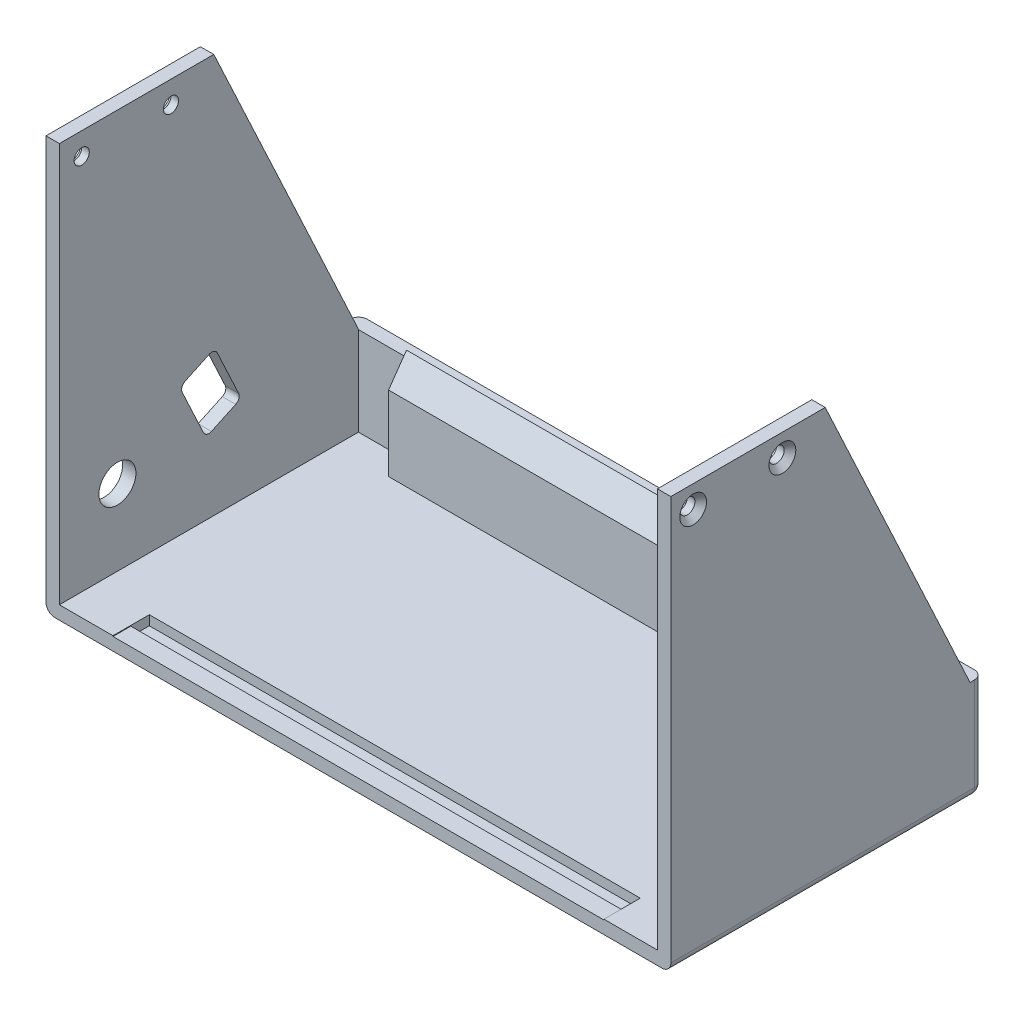
from build123d import *

# Parameters (mm, degrees)
SCHIZZO1_W                         = 140
SCHIZZO1_H                         = 70
ESTRUSIONE_ESTRUSIONE1_DEPTH       = 3
ESTRUSIONE_ESTRUSIONE2_DEPTH       = 110
SCHIZZO4_W                         = 3
SCHIZZO4_H                         = 19.9
ESTRUSIONE_ESTRUSIONE3_DEPTH       = 140
SCHIZZO5_W                         = 3
SCHIZZO5_H                         = 67
ESTRUSIONE_ESTRUSIONE4_DEPTH       = 89.5
TAGLIO_ESTRUSIONE1_REACH           = 183.814
TAGLIO_ESTRUSIONE3_DEPTH           = 110
RACCORDO1_R                        = 2
SCHIZZO8_R                         = 1.7
TAGLIO_ESTRUSIONE4_DEPTH           = 182.813778356
SCHIZZO10_R                        = 3
TAGLIO_ESTRUSIONE5_DEPTH           = 2
TAGLIO_ESTRUSIONE5_DRAFT           = -45
TAGLIO_ESTRUSIONE5_PROFILE_2_DEPTH = 2
TAGLIO_ESTRUSIONE5_PROFILE_2_DRAFT = -45
SCHIZZO11_R                        = 3
TAGLIO_ESTRUSIONE6_DEPTH           = 2
TAGLIO_ESTRUSIONE6_DRAFT           = -45
TAGLIO_ESTRUSIONE6_PROFILE_2_DEPTH = 2
TAGLIO_ESTRUSIONE6_PROFILE_2_DRAFT = -45
TAGLIO_ESTRUSIONE7_DEPTH           = 3
SCHIZZO13_R                        = 4.15
TAGLIO_ESTRUSIONE8_DEPTH           = 10


with BuildPart() as part:
    # Schizzo1 → Estrusione-Estrusione1 (new body)
    with BuildSketch(Plane(origin=(0, 0, 0), x_dir=(1, 0, 0), z_dir=(0, 1, 0))):
        with Locations((-70, -35)):
            Rectangle(SCHIZZO1_W, SCHIZZO1_H)
    extrude(amount=ESTRUSIONE_ESTRUSIONE1_DEPTH)

    # Schizzo2 → Estrusione-Estrusione2 (add)
    with BuildSketch(Plane(origin=(-15, 0, 0), x_dir=(0, 0, -1), z_dir=(1, 0, 0))):
        Polygon((-8.240628014, 3), (-8.240628014, 19.794228272), (-4.225592959, 25.528292582), (-3, 22.9), (-3, 3), align=None)
    extrude(amount=-ESTRUSIONE_ESTRUSIONE2_DEPTH)

    # Schizzo4 → Estrusione-Estrusione3 (add)
    with BuildSketch(Plane(origin=(0, 0, 0), x_dir=(0, 0, -1), z_dir=(1, 0, 0))):
        with Locations((-1.5, 12.95)):
            Rectangle(SCHIZZO4_W, SCHIZZO4_H)
    extrude(amount=-ESTRUSIONE_ESTRUSIONE3_DEPTH)

    # Schizzo5 → Estrusione-Estrusione4 (add)
    with BuildSketch(Plane(origin=(0, 3, 0), x_dir=(1, 0, 0), z_dir=(0, 1, 0))):
        with Locations((-138.5, -36.5)):
            Rectangle(SCHIZZO5_W, SCHIZZO5_H)
        with Locations((-1.5, -36.5)):
            Rectangle(SCHIZZO5_W, SCHIZZO5_H)
    extrude(amount=ESTRUSIONE_ESTRUSIONE4_DEPTH)

    # Taglio-Estrusione1: up to this face of the body (flat: up to its plane)
    taglio_estrusione1_end = Plane(part.part.faces().sort_by_distance((0, 45.868467333, 36.116274616))[0])
    # Schizzo6 → Taglio-Estrusione1 (cut, up to the picked face)
    with BuildSketch(Plane.ZY.offset(140), mode=Mode.PRIVATE) as taglio_estrusione1_sk1:
        Polygon((3, 23), (35.408382242, 92.5), (3, 92.5), align=None)
    taglio_estrusione1_tool1 = split(extrude(taglio_estrusione1_sk1.sketch, amount=-TAGLIO_ESTRUSIONE1_REACH, mode=Mode.PRIVATE), bisect_by=taglio_estrusione1_end, keep=Keep.BOTH, mode=Mode.PRIVATE)
    add(taglio_estrusione1_tool1.solids().sort_by(Axis((-140, 69.333333, 13.802794), (1, 0, 0)))[0], mode=Mode.SUBTRACT)

    # Schizzo7 → Taglio-Estrusione3 (cut)
    with BuildSketch(Plane.ZY.offset(125)):
        Polygon((61.85, 3), (70, 3), (70, 2.85), (66, 2.85), (66, 0.85), (61.85, 0.85), align=None)
    extrude(amount=-TAGLIO_ESTRUSIONE3_DEPTH, mode=Mode.SUBTRACT)

    # Raccordo1
    raccordo1_edges = [part.edges().sort_by_distance(p)[0] for p in [
        (-140, 0, 35),
        (-70, 0, 0),
        (0, 0, 35),
        (-140, 11.45, 0),
        (0, 11.45, 0),
    ]]
    fillet(raccordo1_edges, radius=RACCORDO1_R)

    # Schizzo8 → Taglio-Estrusione4 (cut, through all)
    with BuildSketch(Plane.ZY.offset(140)):
        with Locations((45, 87.5)):
            Circle(SCHIZZO8_R)
        with Locations((65, 87.5)):
            Circle(SCHIZZO8_R)
    extrude(amount=-TAGLIO_ESTRUSIONE4_DEPTH, mode=Mode.SUBTRACT)


with BuildPart() as taglio_estrusione5_tool:
    # Schizzo10 → Taglio-Estrusione5 (with draft: the straight prism first)
    with BuildSketch(Plane.ZY.offset(140)):
        with Locations((45, 87.5)):
            Circle(SCHIZZO10_R)
    extrude(amount=-TAGLIO_ESTRUSIONE5_DEPTH)
    # Taglio-Estrusione5: the draft: its side faces are tilted about the plane it starts from
    taglio_estrusione5_sides = [taglio_estrusione5_tool.faces().sort_by_distance(p)[0] for p in [
        (-139, 87.5, 42),
    ]]
    draft(taglio_estrusione5_sides, Plane.ZY.offset(140), TAGLIO_ESTRUSIONE5_DRAFT)


with BuildPart() as part_1:
    add(part.part)

    # Taglio-Estrusione5: cut by taglio_estrusione5_tool
    add(taglio_estrusione5_tool.part, mode=Mode.SUBTRACT)


with BuildPart() as taglio_estrusione5_profile_2_tool:
    # Schizzo10 → Taglio-Estrusione5 profile 2 (with draft: the straight prism first)
    with BuildSketch(Plane.ZY.offset(140)):
        with Locations((65, 87.5)):
            Circle(SCHIZZO10_R)
    extrude(amount=-TAGLIO_ESTRUSIONE5_PROFILE_2_DEPTH)
    # Taglio-Estrusione5 profile 2: the draft: its side faces are tilted about the plane it starts from
    taglio_estrusione5_profile_2_sides = [taglio_estrusione5_profile_2_tool.faces().sort_by_distance(p)[0] for p in [
        (-139, 87.5, 62),
    ]]
    draft(taglio_estrusione5_profile_2_sides, Plane.ZY.offset(140), TAGLIO_ESTRUSIONE5_PROFILE_2_DRAFT)


with BuildPart() as part_2:
    add(part_1.part)

    # Taglio-Estrusione5 profile 2: cut by taglio_estrusione5_profile_2_tool
    add(taglio_estrusione5_profile_2_tool.part, mode=Mode.SUBTRACT)


with BuildPart() as taglio_estrusione6_tool:
    # Schizzo11 → Taglio-Estrusione6 (with draft: the straight prism first)
    with BuildSketch(Plane(origin=(0, 0, 0), x_dir=(0, 0, -1), z_dir=(1, 0, 0))):
        with Locations((-65, 87.5)):
            Circle(SCHIZZO11_R)
    extrude(amount=-TAGLIO_ESTRUSIONE6_DEPTH)
    # Taglio-Estrusione6: the draft: its side faces are tilted about the plane it starts from
    taglio_estrusione6_sides = [taglio_estrusione6_tool.faces().sort_by_distance(p)[0] for p in [
        (-1, 87.5, 68),
    ]]
    draft(taglio_estrusione6_sides, Plane(origin=(0, 0, 0), x_dir=(0, 0, -1), z_dir=(1, 0, 0)), TAGLIO_ESTRUSIONE6_DRAFT)


with BuildPart() as part_3:
    add(part_2.part)

    # Taglio-Estrusione6: cut by taglio_estrusione6_tool
    add(taglio_estrusione6_tool.part, mode=Mode.SUBTRACT)


with BuildPart() as taglio_estrusione6_profile_2_tool:
    # Schizzo11 → Taglio-Estrusione6 profile 2 (with draft: the straight prism first)
    with BuildSketch(Plane(origin=(0, 0, 0), x_dir=(0, 0, -1), z_dir=(1, 0, 0))):
        with Locations((-45, 87.5)):
            Circle(SCHIZZO11_R)
    extrude(amount=-TAGLIO_ESTRUSIONE6_PROFILE_2_DEPTH)
    # Taglio-Estrusione6 profile 2: the draft: its side faces are tilted about the plane it starts from
    taglio_estrusione6_profile_2_sides = [taglio_estrusione6_profile_2_tool.faces().sort_by_distance(p)[0] for p in [
        (-1, 87.5, 48),
    ]]
    draft(taglio_estrusione6_profile_2_sides, Plane(origin=(0, 0, 0), x_dir=(0, 0, -1), z_dir=(1, 0, 0)), TAGLIO_ESTRUSIONE6_PROFILE_2_DRAFT)


with BuildPart() as part_4:
    add(part_3.part)

    # Taglio-Estrusione6 profile 2: cut by taglio_estrusione6_profile_2_tool
    add(taglio_estrusione6_profile_2_tool.part, mode=Mode.SUBTRACT)

    # Schizzo12 → Taglio-Estrusione7 (cut)
    with BuildSketch(Plane.ZY.offset(140)):
        with BuildLine():
            Line((37.724413642, 20.258722006), (42.5, 30.5))
            ThreePointArc((42.5, 30.5), (42.545069526, 31.532261847), (41.847019141, 32.294050166))
            Line((41.847019141, 32.294050166), (36.409172419, 34.829759736))
            ThreePointArc((36.409172419, 34.829759736), (35.376910572, 34.874829262), (34.615122253, 34.176778877))
            Line((34.615122253, 34.176778877), (29.839535895, 23.935500884))
            ThreePointArc((29.839535895, 23.935500884), (29.79446637, 22.903239037), (30.492516754, 22.141450718))
            Line((30.492516754, 22.141450718), (35.930363476, 19.605741147))
            ThreePointArc((35.930363476, 19.605741147), (36.962625323, 19.560671622), (37.724413642, 20.258722006))
        make_face()
    extrude(amount=-TAGLIO_ESTRUSIONE7_DEPTH, mode=Mode.SUBTRACT)

    # Schizzo13 → Taglio-Estrusione8 (cut)
    with BuildSketch(Plane.ZY.offset(140)):
        with Locations((57, 20)):
            Circle(SCHIZZO13_R)
    extrude(amount=-TAGLIO_ESTRUSIONE8_DEPTH, mode=Mode.SUBTRACT)


solid = part_4.part
